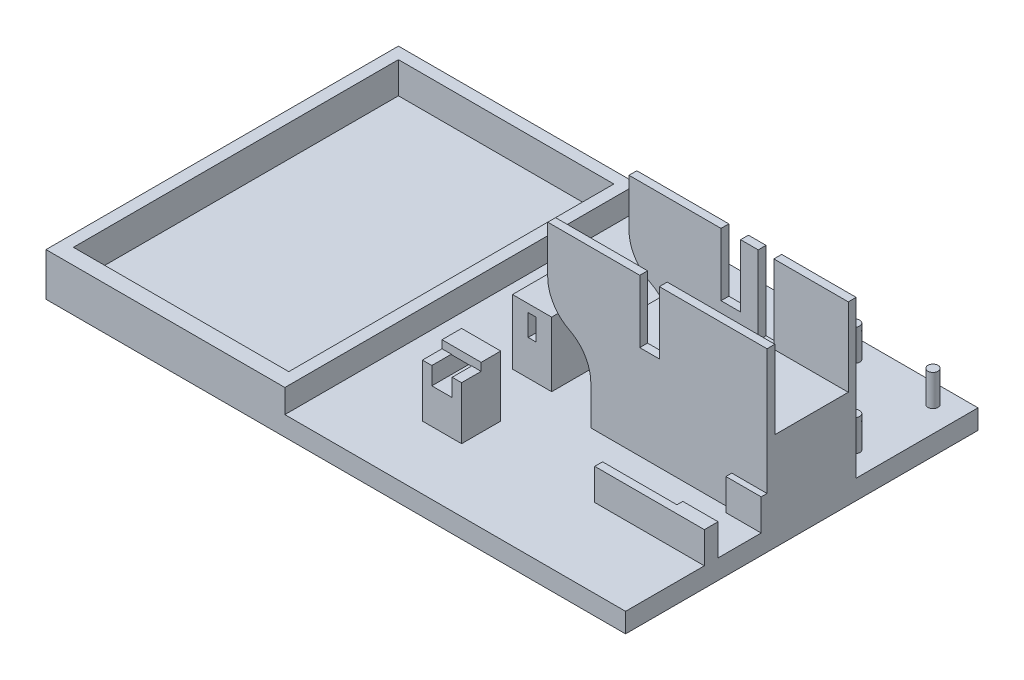
from build123d import *

# Parameters (mm, degrees)
SKETCH3_W               = 120
SKETCH3_H               = 85
BOSS_EXTRUDE1_DEPTH     = 5
SKETCH4_W               = 45
SKETCH4_H               = 18.75
BOSS_EXTRUDE2_DEPTH     = 20
SKETCH6_W               = 45
SKETCH6_H               = 2
BOSS_EXTRUDE3_DEPTH     = 40
CUT_EXTRUDE1_DEPTH      = 87.204698248
CUT_EXTRUDE1_DEPTH_BACK = 20
SKETCH7_W               = 4
SKETCH7_H               = 2
SKETCH8_W               = 10
SKETCH8_H               = 20
BOSS_EXTRUDE4_DEPTH     = 9
BOSS_EXTRUDE5_DEPTH     = 5.5
SKETCH10_W              = 2
SKETCH10_H              = 5.5
CUT_EXTRUDE2_DEPTH      = 91.627068942
SKETCH11_W              = 10
SKETCH11_H              = 10
BOSS_EXTRUDE6_DEPTH     = 2
SKETCH12_W              = 10
SKETCH12_H              = 10
BOSS_EXTRUDE7_DEPTH     = 9
SKETCH13_W              = 2.4
SKETCH13_H              = 10
BOSS_EXTRUDE8_DEPTH     = 4.5
SKETCH14_W              = 10
SKETCH14_H              = 5
BOSS_EXTRUDE9_DEPTH     = 2
SKETCH15_R              = 1.3
BOSS_EXTRUDE10_DEPTH    = 8
SKETCH16_W              = 9
SKETCH16_H              = 1.5
BOSS_EXTRUDE11_DEPTH    = 8
SKETCH18_W              = 120
SKETCH18_H              = 5
BOSS_EXTRUDE12_DEPTH    = 5
SKETCH19_W              = 90
SKETCH19_H              = 5
BOSS_EXTRUDE13_DEPTH    = 30
SKETCH17_W              = 55
SKETCH17_H              = 83
CUT_EXTRUDE3_DEPTH      = 2
SKETCH20_W              = 61
SKETCH20_H              = 90
SKETCH20_W_2            = 55
SKETCH20_H_2            = 83
BOSS_EXTRUDE14_DEPTH    = 6
SKETCH21_W              = 2
SKETCH21_H              = 90
CUT_EXTRUDE4_DEPTH      = 110.344638643
SKETCH22_W              = 5
SKETCH22_H              = 22.75
CUT_EXTRUDE5_DEPTH      = 16
SKETCH23_W              = 2
SKETCH23_H              = 20
BOSS_EXTRUDE15_DEPTH    = 11
FILLET1_R               = 10
FILLET2_R               = 10
SKETCH24_W              = 0.1
SKETCH24_H              = 5.5
CUT_EXTRUDE6_DEPTH      = 8
SKETCH25_W              = 5.2
SKETCH25_H              = 0.1
BOSS_EXTRUDE16_DEPTH    = 5


with BuildPart() as part:
    # Sketch3 → Boss-Extrude1 (new body)
    with BuildSketch(Plane(origin=(0, 0, 0), x_dir=(1, 0, 0), z_dir=(0, 1, 0))):
        Rectangle(SKETCH3_W, SKETCH3_H)
    extrude(amount=BOSS_EXTRUDE1_DEPTH)

    # Sketch4 → Boss-Extrude2 (add)
    with BuildSketch(Plane(origin=(0, 5, 0), x_dir=(1, 0, 0), z_dir=(0, 1, 0))):
        with Locations((37.5, 0)):
            Rectangle(SKETCH4_W, SKETCH4_H)
    extrude(amount=BOSS_EXTRUDE2_DEPTH)

    # Sketch6 → Boss-Extrude3 (add)
    with BuildSketch(Plane(origin=(0, 5, 0), x_dir=(1, 0, 0), z_dir=(0, 1, 0))):
        with Locations((37.5, 10.375)):
            Rectangle(SKETCH6_W, SKETCH6_H)
        with Locations((37.5, -10.375)):
            Rectangle(SKETCH6_W, SKETCH6_H)
    extrude(amount=BOSS_EXTRUDE3_DEPTH)

    # Sketch7 → Cut-Extrude1 (cut, two sides: drawn at the far end of the back side and taken through both)
    with BuildSketch(Plane(origin=(0, 45, 0), x_dir=(1, 0, 0), z_dir=(0, 1, 0)).offset(-CUT_EXTRUDE1_DEPTH_BACK)):
        with Locations((39, 10.375)):
            Rectangle(SKETCH7_W, SKETCH7_H)
    extrude(amount=CUT_EXTRUDE1_DEPTH + CUT_EXTRUDE1_DEPTH_BACK, mode=Mode.SUBTRACT)

    # Sketch8 → Boss-Extrude4 (add)
    with BuildSketch(Plane(origin=(0, 5, 0), x_dir=(1, 0, 0), z_dir=(0, 1, 0))):
        with Locations((-3, 1.625)):
            Rectangle(SKETCH8_W, SKETCH8_H)
    extrude(amount=BOSS_EXTRUDE4_DEPTH)

    # Sketch9 → Boss-Extrude5 (add)
    with BuildSketch(Plane(origin=(0, 14, 0), x_dir=(1, 0, 0), z_dir=(0, 1, 0))):
        Polygon((-8, -8.375), (2, -8.375), (2, 1.625), (-0.75, 1.625), (-0.75, -6.375), (-5.25, -6.375), (-5.25, 1.625), (-8, 1.625), align=None)
    extrude(amount=BOSS_EXTRUDE5_DEPTH)

    # Sketch10 → Cut-Extrude2 (cut, through all)
    with BuildSketch(Plane.XY.offset(8.375)):
        with Locations((-3, 16.75)):
            Rectangle(SKETCH10_W, SKETCH10_H)
    extrude(amount=-CUT_EXTRUDE2_DEPTH, mode=Mode.SUBTRACT)

    # Sketch11 → Boss-Extrude6 (add)
    with BuildSketch(Plane(origin=(0, 19.5, 0), x_dir=(1, 0, 0), z_dir=(0, 1, 0))):
        with Locations((-3, -3.375)):
            Rectangle(SKETCH11_W, SKETCH11_H)
    extrude(amount=BOSS_EXTRUDE6_DEPTH)

    # Sketch12 → Boss-Extrude7 (add)
    with BuildSketch(Plane(origin=(0, 5, 0), x_dir=(1, 0, 0), z_dir=(0, 1, 0))):
        with Locations((-3, -26.375)):
            Rectangle(SKETCH12_W, SKETCH12_H)
    extrude(amount=BOSS_EXTRUDE7_DEPTH)

    # Sketch13 → Boss-Extrude8 (add)
    with BuildSketch(Plane(origin=(0, 14, 0), x_dir=(1, 0, 0), z_dir=(0, 1, 0))):
        with Locations((-6.8, -26.375)):
            Rectangle(SKETCH13_W, SKETCH13_H)
        with Locations((0.8, -26.375)):
            Rectangle(SKETCH13_W, SKETCH13_H)
    extrude(amount=BOSS_EXTRUDE8_DEPTH)

    # Sketch14 → Boss-Extrude9 (add)
    with BuildSketch(Plane(origin=(0, 18.5, 0), x_dir=(1, 0, 0), z_dir=(0, 1, 0))):
        with Locations((-3, -23.875)):
            Rectangle(SKETCH14_W, SKETCH14_H)
    extrude(amount=BOSS_EXTRUDE9_DEPTH)

    # Sketch15 → Boss-Extrude10 (add)
    with BuildSketch(Plane(origin=(0, 5, 0), x_dir=(1, 0, 0), z_dir=(0, 1, 0))):
        with Locations(Location((33.5, 37.5, 0), (0, 0, 90))):
            Circle(SKETCH15_R)
        with Locations(Location((53.5, 37.5, 0), (0, 0, 90))):
            Circle(SKETCH15_R)
        with Locations(Location((53.5, 17.5, 0), (0, 0, 90))):
            Circle(SKETCH15_R)
        with Locations(Location((33.5, 17.5, 0), (0, 0, 90))):
            Circle(SKETCH15_R)
    extrude(amount=BOSS_EXTRUDE10_DEPTH)

    # Sketch16 → Boss-Extrude11 (add)
    with BuildSketch(Plane(origin=(0, 5, 0), x_dir=(1, 0, 0), z_dir=(0, 1, 0))):
        with Locations((55.5, -12.125)):
            Rectangle(SKETCH16_W, SKETCH16_H)
        Polygon((51, -25.375), (32, -25.375), (32, -27.375), (60, -27.375), (60, -25.375), align=None)
        with Locations((55.5, -24.625)):
            Rectangle(SKETCH16_W, SKETCH16_H)
    extrude(amount=BOSS_EXTRUDE11_DEPTH)

    # Sketch18 → Boss-Extrude12 (add)
    with BuildSketch(Plane.XY.offset(42.5)):
        with Locations((0, 2.5)):
            Rectangle(SKETCH18_W, SKETCH18_H)
    extrude(amount=BOSS_EXTRUDE12_DEPTH)

    # Sketch19 → Boss-Extrude13 (add)
    with BuildSketch(Plane.ZY.offset(60)):
        with Locations((2.5, 2.5)):
            Rectangle(SKETCH19_W, SKETCH19_H)
    extrude(amount=BOSS_EXTRUDE13_DEPTH)

    # Sketch17 → Cut-Extrude3 (cut)
    with BuildSketch(Plane(origin=(0, 5, 0), x_dir=(1, 0, 0), z_dir=(0, 1, 0))):
        with Locations((-57.5, -2)):
            Rectangle(SKETCH17_W, SKETCH17_H)
    extrude(amount=-CUT_EXTRUDE3_DEPTH, mode=Mode.SUBTRACT)

    # Sketch20 → Boss-Extrude14 (add)
    with BuildSketch(Plane(origin=(0, 5, 0), x_dir=(1, 0, 0), z_dir=(0, 1, 0))):
        with Locations((-57.5, -2.5)):
            Rectangle(SKETCH20_W, SKETCH20_H)
        with Locations((-57.5, -2)):
            Rectangle(SKETCH20_W_2, SKETCH20_H_2, mode=Mode.SUBTRACT)
    extrude(amount=BOSS_EXTRUDE14_DEPTH)

    # Sketch21 → Cut-Extrude4 (cut, through all)
    with BuildSketch(Plane(origin=(0, 5, 0), x_dir=(1, 0, 0), z_dir=(0, 1, 0))):
        with Locations((-89, -2.5)):
            Rectangle(SKETCH21_W, SKETCH21_H)
    extrude(amount=-CUT_EXTRUDE4_DEPTH, mode=Mode.SUBTRACT)

    # Sketch22 → Cut-Extrude5 (cut)
    with BuildSketch(Plane(origin=(0, 45, 0), x_dir=(1, 0, 0), z_dir=(0, 1, 0))):
        with Locations((30, 0)):
            Rectangle(SKETCH22_W, SKETCH22_H)
    extrude(amount=-CUT_EXTRUDE5_DEPTH, mode=Mode.SUBTRACT)

    # Sketch23 → Boss-Extrude15 (add)
    with BuildSketch(Plane.ZY.offset(-15)):
        with Locations((-10.375, 35)):
            Rectangle(SKETCH23_W, SKETCH23_H)
        with Locations((10.375, 35)):
            Rectangle(SKETCH23_W, SKETCH23_H)
    extrude(amount=BOSS_EXTRUDE15_DEPTH)

    # Fillet1
    fillet1_edges = [part.edges().sort_by_distance(p)[0] for p in [
        (15, 25, -10.375),
        (15, 25, 10.375),
    ]]
    fillet(fillet1_edges, radius=FILLET1_R)

    # Fillet2
    fillet2_edges = [part.edges().sort_by_distance(p)[0] for p in [
        (4, 25, -10.375),
        (4, 25, 10.375),
    ]]
    fillet(fillet2_edges, radius=FILLET2_R)

    # Sketch24 → Cut-Extrude6 (cut)
    with BuildSketch(Plane(origin=(0, 0, -1.625), x_dir=(-1, 0, 0), z_dir=(0, 0, -1))):
        Polygon((0.75, 19.5), (5.25, 19.5), (5.35, 19.5), (5.35, 19.6), (0.65, 19.6), (0.65, 19.5), align=None)
        with Locations((5.3, 16.75)):
            Rectangle(SKETCH24_W, SKETCH24_H)
        with Locations((0.7, 16.75)):
            Rectangle(SKETCH24_W, SKETCH24_H)
    extrude(amount=-CUT_EXTRUDE6_DEPTH, mode=Mode.SUBTRACT)

    # Sketch25 → Boss-Extrude16 (add)
    with BuildSketch(Plane(origin=(0, 0, 21.375), x_dir=(-1, 0, 0), z_dir=(0, 0, -1))):
        with Locations((3, 18.45)):
            Rectangle(SKETCH25_W, SKETCH25_H)
    extrude(amount=-BOSS_EXTRUDE16_DEPTH)


solid = part.part
